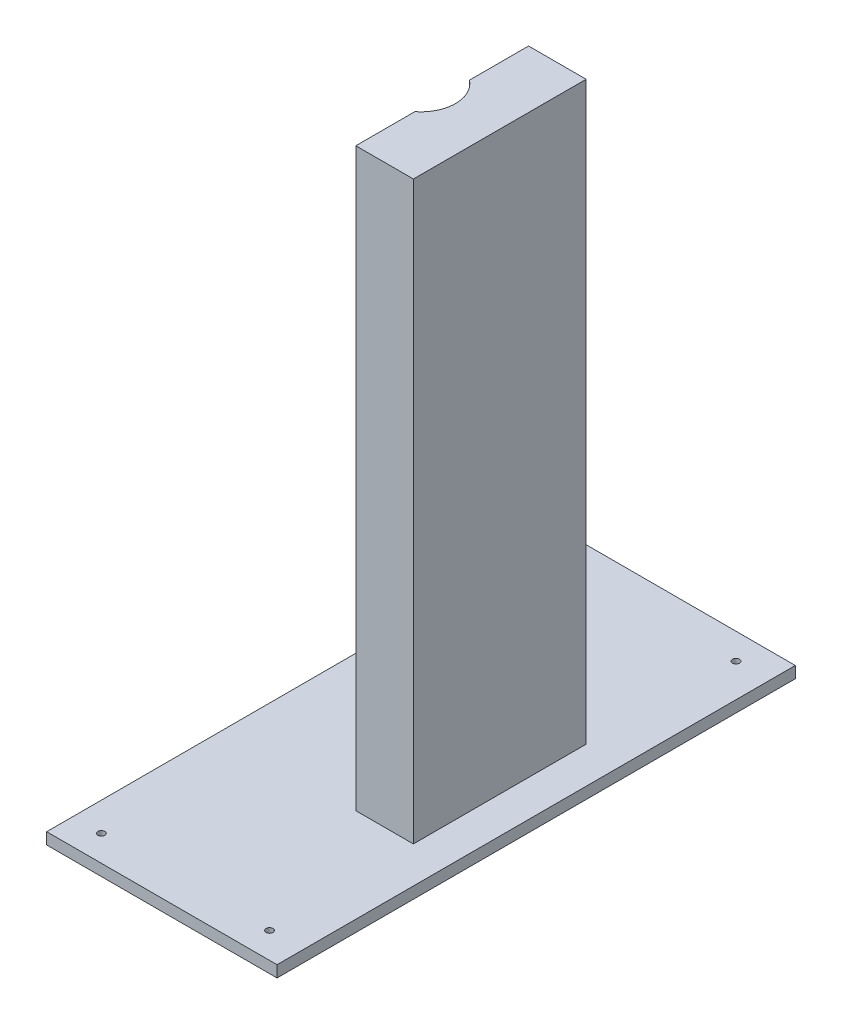
from build123d import *

# Parameters (mm, degrees)
SKETCH1_W           = 200
SKETCH1_H           = 450
SKETCH1_R           = 3
BOSS_EXTRUDE1_DEPTH = 10
BOSS_EXTRUDE2_DEPTH = 300
BOSS_EXTRUDE3_DEPTH = 500


with BuildPart() as part:
    # Sketch1 → Boss-Extrude1 (new body)
    with BuildSketch(Plane(origin=(0, 0, 0), x_dir=(1, 0, 0), z_dir=(0, 1, 0))):
        Rectangle(SKETCH1_W, SKETCH1_H)
        with Locations((-75, 202.5)):
            Circle(SKETCH1_R, mode=Mode.SUBTRACT)
        with Locations((71, 202.5)):
            Circle(SKETCH1_R, mode=Mode.SUBTRACT)
        with Locations((71, -202.5)):
            Circle(SKETCH1_R, mode=Mode.SUBTRACT)
        with Locations((-75, -202.5)):
            Circle(SKETCH1_R, mode=Mode.SUBTRACT)
    extrude(amount=BOSS_EXTRUDE1_DEPTH)

    # Sketch2 → Boss-Extrude2 (add)
    with BuildSketch(Plane(origin=(0, 10, 0), x_dir=(1, 0, 0), z_dir=(0, 1, 0))):
        with BuildLine():
            ThreePointArc((30, 0), (26.942793817, 13.194160122), (18.394275911, 23.699169051))
            ThreePointArc((18.394275911, 23.699169051), (-13.194160122, 26.942793817), (-30, 0))
            ThreePointArc((-30, 0), (-13.194160122, -26.942793817), (18.394275911, -23.699169051))
            ThreePointArc((18.394275911, -23.699169051), (26.942793817, -13.194160122), (30, 0))
        make_face()
    extrude(amount=BOSS_EXTRUDE2_DEPTH)

    # Sketch2<3> → Boss-Extrude3 (add)
    with BuildSketch(Plane(origin=(0, 10, 0), x_dir=(1, 0, 0), z_dir=(0, 1, 0))):
        with BuildLine():
            Line((18.394275911, 75), (18.394275911, 23.699169051))
            ThreePointArc((18.394275911, 23.699169051), (26.942793817, 13.194160122), (30, 0))
            ThreePointArc((30, 0), (26.942793817, -13.194160122), (18.394275911, -23.699169051))
            Line((18.394275911, -23.699169051), (18.394275911, -75))
            Line((18.394275911, -75), (68.394275911, -75))
            Line((68.394275911, -75), (68.394275911, 75))
            Line((68.394275911, 75), (18.394275911, 75))
        make_face()
    extrude(amount=BOSS_EXTRUDE3_DEPTH)


solid = part.part
